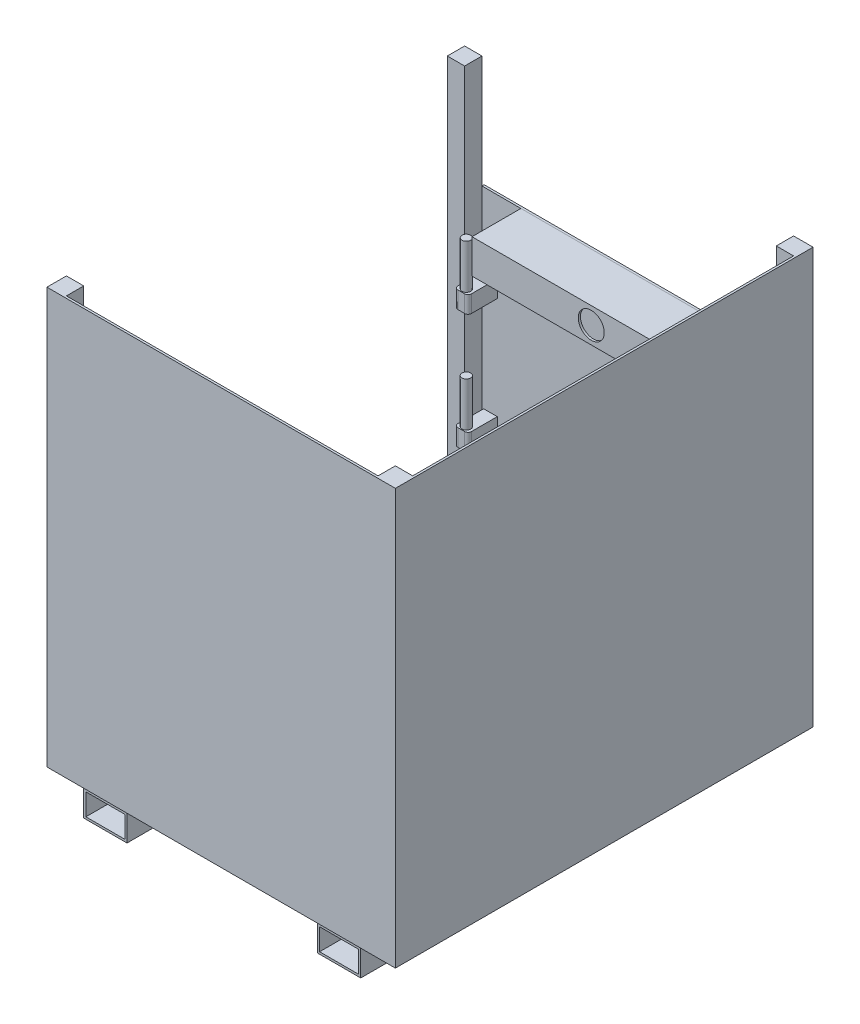
from build123d import *

# Parameters (mm, degrees)
SKETCH3_W                = 50.8
SKETCH3_H                = 50.8
BOSS_EXTRUDE1_DEPTH      = 1219.2
BOSS_EXTRUDE1_2_DEPTH    = 1219.2
BOSS_EXTRUDE1_3_DEPTH    = 1219.2
BOSS_EXTRUDE1_4_DEPTH    = 1219.2
SKETCH4_W                = 1219.2
SKETCH4_H                = 1219.2
BOSS_EXTRUDE2_DEPTH      = 6.35
SKETCH6_W                = 1022.35
SKETCH6_H                = 1219.2
BOSS_EXTRUDE4_DEPTH      = 6.35
BOSS_EXTRUDE7_DEPTH      = 6
BOSS_EXTRUDE7_DEPTH_BACK = 0.35
SKETCH7_W                = 1016
SKETCH7_H                = 1219.2
SKETCH8_W                = 914.4
SKETCH8_H                = 889
BOSS_EXTRUDE8_DEPTH      = 6.35
BOSS_EXTRUDE18_DEPTH     = 800
SKETCH12_W               = 127
SKETCH12_H               = 76.2
SKETCH12_W_2             = 114.3
SKETCH12_H_2             = 63.5
BOSS_EXTRUDE19_DEPTH     = 1219.2
SKETCH17_W               = 31.75
SKETCH17_H               = 31.75
BOSS_EXTRUDE20_DEPTH     = 457.2
BOSS_EXTRUDE21_START     = 325
SKETCH18_R               = 12.7
BOSS_EXTRUDE21_DEPTH     = 480
SKETCH19_W               = 25.4
SKETCH19_H               = 220
CUT_EXTRUDE3_DEPTH       = 100
BOSS_EXTRUDE23_DEPTH     = 50
BOSS_EXTRUDE25_START     = 350
BOSS_EXTRUDE25_DEPTH     = 50
SKETCH21_R               = 38.1
CUT_EXTRUDE4_DEPTH       = 6.35


with BuildPart() as part:
    # Sketch3 → Boss-Extrude1 (new body)
    with BuildSketch(Plane(origin=(0, 0, 0), x_dir=(1, 0, 0), z_dir=(0, 1, 0))):
        with Locations((25.4, 25.4)):
            Rectangle(SKETCH3_W, SKETCH3_H)
    extrude(amount=BOSS_EXTRUDE1_DEPTH)



with BuildPart() as body_2:
    # Sketch3 → Boss-Extrude1 2 (new body)
    with BuildSketch(Plane(origin=(0, 0, 0), x_dir=(1, 0, 0), z_dir=(0, 1, 0))):
        with Locations((990.6, 25.4)):
            Rectangle(SKETCH3_W, SKETCH3_H)
    extrude(amount=BOSS_EXTRUDE1_2_DEPTH)



with BuildPart() as body_3:
    # Sketch3 → Boss-Extrude1 3 (new body)
    with BuildSketch(Plane(origin=(0, 0, 0), x_dir=(1, 0, 0), z_dir=(0, 1, 0))):
        with Locations((25.4, 1193.8)):
            Rectangle(SKETCH3_W, SKETCH3_H)
    extrude(amount=BOSS_EXTRUDE1_3_DEPTH)


with BuildPart() as body_4:
    # Sketch3 → Boss-Extrude1 4 (new body)
    with BuildSketch(Plane(origin=(0, 0, 0), x_dir=(1, 0, 0), z_dir=(0, 1, 0))):
        with Locations((990.6, 1193.8)):
            Rectangle(SKETCH3_W, SKETCH3_H)
    extrude(amount=BOSS_EXTRUDE1_4_DEPTH)


with BuildPart() as body_2_1:
    add(body_2.part)

    add(body_4.part)  # Boss-Extrude2 merges body 4
    # Sketch4 → Boss-Extrude2 (add)
    with BuildSketch(Plane(origin=(1016, 0, 0), x_dir=(0, 0, -1), z_dir=(1, 0, 0))):
        with Locations((609.6, 609.6)):
            Rectangle(SKETCH4_W, SKETCH4_H)
    extrude(amount=BOSS_EXTRUDE2_DEPTH)


with BuildPart() as part_1:
    add(part.part)

    add(body_2_1.part)  # Boss-Extrude4 merges body 2
    # Sketch6 → Boss-Extrude4 (add)
    with BuildSketch(Plane.XY):
        with Locations((511.175, 609.6)):
            Rectangle(SKETCH6_W, SKETCH6_H)
    extrude(amount=BOSS_EXTRUDE4_DEPTH)


    add(body_3.part)  # Boss-Extrude7 merges body 3
    # Sketch7 → Boss-Extrude7 (add, two sides: drawn at the far end of the back side and taken through both)
    with BuildSketch(Plane.XZ.offset(-BOSS_EXTRUDE7_DEPTH_BACK)):
        with Locations((508, -609.6)):
            Rectangle(SKETCH7_W, SKETCH7_H)
    extrude(amount=BOSS_EXTRUDE7_DEPTH + BOSS_EXTRUDE7_DEPTH_BACK)

    # Sketch12 → Boss-Extrude19 (add)
    # profile 1 of 2: a face of its own
    with BuildSketch(Plane.XY):
        with Locations((165.1, -44.1)):
            Rectangle(SKETCH12_W, SKETCH12_H)
        with Locations((165.1, -44.1)):
            Rectangle(SKETCH12_W_2, SKETCH12_H_2, mode=Mode.SUBTRACT)
    # profile 2 of 2: a face of its own
    with BuildSketch(Plane.XY):
        with Locations((850.9, -44.1)):
            Rectangle(SKETCH12_W, SKETCH12_H)
        with Locations((850.9, -44.1)):
            Rectangle(SKETCH12_W_2, SKETCH12_H_2, mode=Mode.SUBTRACT)
    extrude(amount=-BOSS_EXTRUDE19_DEPTH)

    # Sketch17 → Boss-Extrude20 (add)
    with BuildSketch(Plane(origin=(0, 0.35, 0), x_dir=(1, 0, 0), z_dir=(0, 1, 0))):
        with Locations((339.725, 504.825)):
            Rectangle(SKETCH17_W, SKETCH17_H)
        with Locations((676.275, 504.825)):
            Rectangle(SKETCH17_W, SKETCH17_H)
        with Locations((339.725, 168.275)):
            Rectangle(SKETCH17_W, SKETCH17_H)
        with Locations((676.275, 168.275)):
            Rectangle(SKETCH17_W, SKETCH17_H)
    extrude(amount=BOSS_EXTRUDE20_DEPTH)


with BuildPart() as body_2_2:
    # Sketch8 → Boss-Extrude8 (new body)
    with BuildSketch(Plane(origin=(0, 0, -1219.2), x_dir=(-1, 0, 0), z_dir=(0, 0, -1))):
        with Locations((-508, 444.5)):
            Rectangle(SKETCH8_W, SKETCH8_H)
    extrude(amount=BOSS_EXTRUDE8_DEPTH)


with BuildPart() as body_3_2:
    # Sketch11 → Boss-Extrude18 (new body)
    with BuildSketch(Plane.ZY.offset(-965.2)):
        Polygon((-1225.55, 639), (-1075.55, 789), (-1075.55, 889), (-1225.55, 889), align=None)
        Polygon((-1212.85, 882.65), (-1081.9, 882.65), (-1081.9, 791.630256121), (-1212.85, 660.680256121), align=None, mode=Mode.SUBTRACT)
    extrude(amount=BOSS_EXTRUDE18_DEPTH)

    # Sketch21 → Cut-Extrude4 (cut)
    with BuildSketch(Plane.XY.offset(-1075.55)):
        with Locations((515.2, 839)):
            Circle(SKETCH21_R)
    extrude(amount=-CUT_EXTRUDE4_DEPTH, mode=Mode.SUBTRACT)


with BuildPart() as body_4_2:
    # Sketch18 → Boss-Extrude21 (new body)
    with BuildSketch(Plane(origin=(0, 0.35, 0), x_dir=(1, 0, 0), z_dir=(0, 1, 0)).offset(BOSS_EXTRUDE21_START)):
        with Locations(Location((75.8, 1148.4, 0), (0, 0, 270))):
            Circle(SKETCH18_R)
    extrude(amount=BOSS_EXTRUDE21_DEPTH)

    # Sketch19 → Cut-Extrude3 (cut)
    with BuildSketch(Plane.ZY):
        with Locations((-1148.4, 565.35)):
            Rectangle(SKETCH19_W, SKETCH19_H)
    extrude(amount=-CUT_EXTRUDE3_DEPTH, mode=Mode.SUBTRACT)


with BuildPart() as cut_extrude3_piece_1:
    # of the separate pieces the step leaves, piece 1, a body of its own (cut_extrude3_pieces)
    add(body_4_2.part.solids().sort_by_distance((75.8, 325.35, -1135.7))[0])


with BuildPart() as cut_extrude3_piece_2:
    # of the separate pieces the step leaves, piece 2, a body of its own (cut_extrude3_pieces)
    add(body_4_2.part.solids().sort_by_distance((75.8, 675.35, -1135.7))[0])


with BuildPart() as body_6:
    # Sketch20 → Boss-Extrude23 (new body)
    with BuildSketch(Plane.XZ.offset(-675.35)):
        with BuildLine():
            Line((95.8, -1219.2), (55.8, -1219.2))
            Line((55.8, -1219.2), (55.8, -1143.4))
            ThreePointArc((55.8, -1143.4), (58.728932188, -1136.328932188), (65.8, -1133.4))
            Line((65.8, -1133.4), (85.8, -1133.4))
            ThreePointArc((85.8, -1133.4), (92.871067812, -1136.328932188), (95.8, -1143.4))
            Line((95.8, -1143.4), (95.8, -1219.2))
        make_face()
    extrude(amount=BOSS_EXTRUDE23_DEPTH)


with BuildPart() as body_7:
    # Sketch20<2> → Boss-Extrude25 (new body)
    with BuildSketch(Plane.XZ.offset(-675.35).offset(BOSS_EXTRUDE25_START)):
        with BuildLine():
            Line((95.8, -1219.2), (55.8, -1219.2))
            Line((55.8, -1219.2), (55.8, -1143.4))
            ThreePointArc((55.8, -1143.4), (58.728932188, -1136.328932188), (65.8, -1133.4))
            Line((65.8, -1133.4), (85.8, -1133.4))
            ThreePointArc((85.8, -1133.4), (92.871067812, -1136.328932188), (95.8, -1143.4))
            Line((95.8, -1143.4), (95.8, -1219.2))
        make_face()
    extrude(amount=BOSS_EXTRUDE25_DEPTH)


solid = Compound([part_1.part, body_2_2.part, body_3_2.part, cut_extrude3_piece_1.part, cut_extrude3_piece_2.part, body_6.part, body_7.part])
